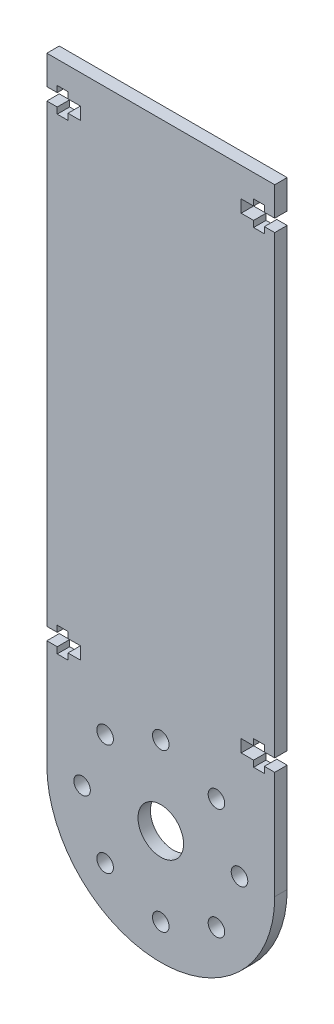
from build123d import *

# Parameters (mm, degrees)
SKETCH_1_R      = 5.5
SKETCH_1_R_2    = 2
EXTRUDE_1_DEPTH = 3


with BuildPart() as part:
    # 草图1 → 凸台-拉伸1 (new body)
    with BuildSketch(Plane.XY):
        with BuildLine():
            Line((222.453360513, -82.216557036), (222.453360513, -75.216557036))
            Line((222.453360513, -75.216557036), (277.453360513, -75.216557036))
            Line((277.453360513, -75.216557036), (277.453360513, -82.216557036))
            Line((277.453360513, -82.216557036), (274.953360513, -82.216557036))
            Line((274.953360513, -82.216557036), (274.953360513, -80.716557036))
            Line((274.953360513, -80.716557036), (272.353360513, -80.716557036))
            Line((272.353360513, -80.716557036), (272.353360513, -82.216557036))
            Line((272.353360513, -82.216557036), (269.353360513, -82.216557036))
            Line((269.353360513, -82.216557036), (269.353360513, -85.216557036))
            Line((269.353360513, -85.216557036), (272.353360513, -85.216557036))
            Line((272.353360513, -85.216557036), (272.353360513, -86.716557036))
            Line((272.353360513, -86.716557036), (274.953360513, -86.716557036))
            Line((274.953360513, -86.716557036), (274.953360513, -85.216557036))
            Line((274.953360513, -85.216557036), (277.453360513, -85.216557036))
            Line((277.453360513, -85.216557036), (277.453360513, -195.037068397))
            Line((277.453360513, -195.037068397), (274.953360513, -195.037068397))
            Line((274.953360513, -195.037068397), (274.953360513, -193.537068397))
            Line((274.953360513, -193.537068397), (272.353360513, -193.537068397))
            Line((272.353360513, -193.537068397), (272.353360513, -195.037068397))
            Line((272.353360513, -195.037068397), (269.353360513, -195.037068397))
            Line((269.353360513, -195.037068397), (269.353360513, -198.037068397))
            Line((269.353360513, -198.037068397), (272.353360513, -198.037068397))
            Line((272.353360513, -198.037068397), (272.353360513, -199.537068397))
            Line((272.353360513, -199.537068397), (274.953360513, -199.537068397))
            Line((274.953360513, -199.537068397), (274.953360513, -198.037068397))
            Line((274.953360513, -198.037068397), (277.453360513, -198.037068397))
            Line((277.453360513, -198.037068397), (277.453360513, -224.037068397))
            ThreePointArc((277.453360513, -224.037068397), (249.953360513, -251.537068397), (222.453360513, -224.037068397))
            Line((222.453360513, -224.037068397), (222.453360513, -198.037068397))
            Line((222.453360513, -198.037068397), (224.953360513, -198.037068397))
            Line((224.953360513, -198.037068397), (224.953360513, -199.537068397))
            Line((224.953360513, -199.537068397), (227.553360513, -199.537068397))
            Line((227.553360513, -199.537068397), (227.553360513, -198.037068397))
            Line((227.553360513, -198.037068397), (230.553360513, -198.037068397))
            Line((230.553360513, -198.037068397), (230.553360513, -195.037068397))
            Line((230.553360513, -195.037068397), (227.553360513, -195.037068397))
            Line((227.553360513, -195.037068397), (227.553360513, -193.537068397))
            Line((227.553360513, -193.537068397), (224.953360513, -193.537068397))
            Line((224.953360513, -193.537068397), (224.953360513, -195.037068397))
            Line((224.953360513, -195.037068397), (222.453360513, -195.037068397))
            Line((222.453360513, -195.037068397), (222.453360513, -85.216557036))
            Line((222.453360513, -85.216557036), (224.953360513, -85.216557036))
            Line((224.953360513, -85.216557036), (224.953360513, -86.716557036))
            Line((224.953360513, -86.716557036), (227.553360513, -86.716557036))
            Line((227.553360513, -86.716557036), (227.553360513, -85.216557036))
            Line((227.553360513, -85.216557036), (230.553360513, -85.216557036))
            Line((230.553360513, -85.216557036), (230.553360513, -82.216557036))
            Line((230.553360513, -82.216557036), (227.553360513, -82.216557036))
            Line((227.553360513, -82.216557036), (227.553360513, -80.716557036))
            Line((227.553360513, -80.716557036), (224.953360513, -80.716557036))
            Line((224.953360513, -80.716557036), (224.953360513, -82.216557036))
            Line((224.953360513, -82.216557036), (222.453360513, -82.216557036))
        make_face()
        with Locations((249.953360513, -224.037068397)):
            Circle(SKETCH_1_R, mode=Mode.SUBTRACT)
        with Locations((249.953360513, -205.037068397)):
            Circle(SKETCH_1_R_2, mode=Mode.SUBTRACT)
        with Locations((263.388389356, -210.602039555)):
            Circle(SKETCH_1_R_2, mode=Mode.SUBTRACT)
        with Locations((268.953360513, -224.037068397)):
            Circle(SKETCH_1_R_2, mode=Mode.SUBTRACT)
        with Locations((263.388389356, -237.47209724)):
            Circle(SKETCH_1_R_2, mode=Mode.SUBTRACT)
        with Locations((249.953360513, -243.037068397)):
            Circle(SKETCH_1_R_2, mode=Mode.SUBTRACT)
        with Locations((236.518331671, -237.47209724)):
            Circle(SKETCH_1_R_2, mode=Mode.SUBTRACT)
        with Locations((230.953360513, -224.037068397)):
            Circle(SKETCH_1_R_2, mode=Mode.SUBTRACT)
        with Locations((236.518331671, -210.602039555)):
            Circle(SKETCH_1_R_2, mode=Mode.SUBTRACT)
    extrude(amount=EXTRUDE_1_DEPTH)


solid = part.part
